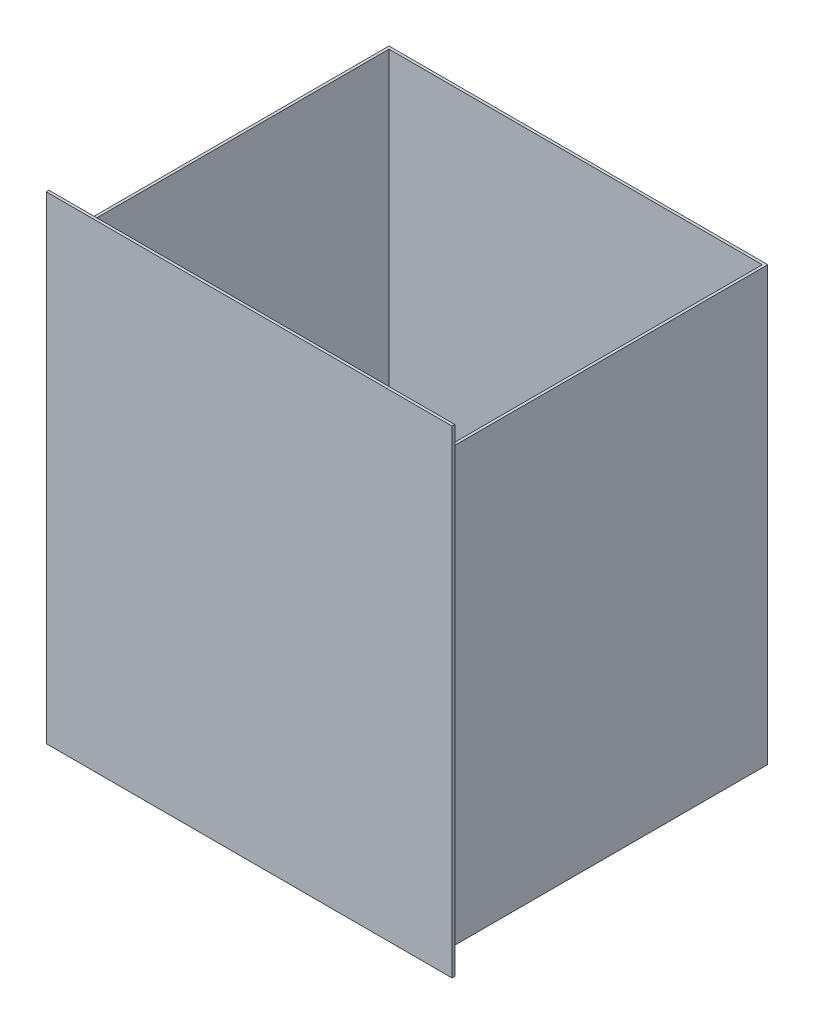
from build123d import *

# Parameters (mm, degrees)
SKETCH_1_W        = 420
SKETCH_1_H        = 360
EXTRUDE_1_DEPTH   = 3
SKETCH_2_W        = 420
SKETCH_2_H        = 360
SKETCH_2_W_2      = 414
SKETCH_2_H_2      = 354
EXTRUDE_1_2_DEPTH = 477
SKETCH_3_W        = 450
SKETCH_3_H        = 530
EXTRUDE_2_DEPTH   = 3


with BuildPart() as part:
    # 草图1 → Extrude 1 (new body)
    with BuildSketch(Plane(origin=(0, 0, 0), x_dir=(1, 0, 0), z_dir=(0, 1, 0))):
        Rectangle(SKETCH_1_W, SKETCH_1_H)
    extrude(amount=EXTRUDE_1_DEPTH)

    # 草图2 → Extrude 1 2 (add)
    with BuildSketch(Plane(origin=(0, 3, 0), x_dir=(1, 0, 0), z_dir=(0, 1, 0))):
        Rectangle(SKETCH_2_W, SKETCH_2_H)
        Rectangle(SKETCH_2_W_2, SKETCH_2_H_2, mode=Mode.SUBTRACT)
    extrude(amount=EXTRUDE_1_2_DEPTH)

    # 草图3 → 凸台-拉伸2 (add)
    with BuildSketch(Plane.XY.offset(180)):
        with Locations((-5, 245)):
            Rectangle(SKETCH_3_W, SKETCH_3_H)
    extrude(amount=-EXTRUDE_2_DEPTH)


solid = part.part
